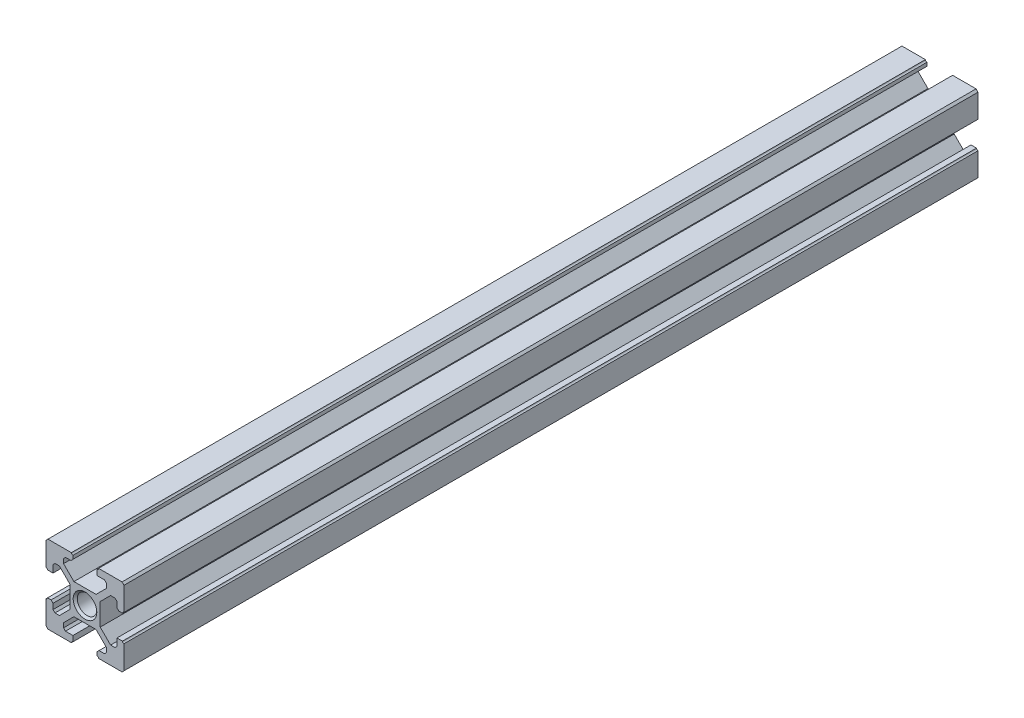
from build123d import *

# Parameters (mm, degrees)
BOSS_EXTRUDE1_DEPTH             = 219
M6X1_0_TAPPED_HOLE2_D           = 5
M6X1_0_TAPPED_HOLE2_DEPTH       = 28.497848452
M6X1_0_TAPPED_HOLE2_CSINK_D     = 6.05
M6X1_0_TAPPED_HOLE2_CSINK_ANGLE = 90
M6X1_0_TAPPED_HOLE2_TIP         = 1.502151548


with BuildPart() as part:
    # Sketch1 → Boss-Extrude1 (new body)
    with BuildSketch(Plane.XY):
        with BuildLine():
            Line((-9.5, 10), (-3.486470896, 10))
            ThreePointArc((-3.486470896, 10), (-3.373276191, 9.726723809), (-3.1, 9.613529104))
            Line((-3.1, 9.613529104), (-3.1, 8.7))
            Line((-3.1, 8.7), (-3.6, 8.2))
            Line((-3.6, 8.2), (-5, 8.2))
            Line((-5, 8.2), (-5.5, 7.7))
            Line((-5.5, 7.7), (-5.5, 6.560660172))
            Line((-5.5, 6.560660172), (-2.839339828, 3.9))
            Line((-2.839339828, 3.9), (0, 3.9))
            Line((0, 3.9), (2.839339828, 3.9))
            Line((2.839339828, 3.9), (5.5, 6.560660172))
            Line((5.5, 6.560660172), (5.5, 7.7))
            Line((5.5, 7.7), (5, 8.2))
            Line((5, 8.2), (3.1, 8.2))
            Line((3.1, 8.2), (3.1, 9.613529104))
            ThreePointArc((3.1, 9.613529104), (3.373276191, 9.726723809), (3.486470896, 10))
            Line((3.486470896, 10), (9.5, 10))
            Line((9.5, 10), (10, 9.5))
            Line((10, 9.5), (10, 3.486470896))
            ThreePointArc((10, 3.486470896), (9.726723809, 3.373276191), (9.613529104, 3.1))
            Line((9.613529104, 3.1), (8.7, 3.1))
            Line((8.7, 3.1), (8.2, 3.6))
            Line((8.2, 3.6), (8.2, 5))
            Line((8.2, 5), (7.7, 5.5))
            Line((7.7, 5.5), (6.560660172, 5.5))
            Line((6.560660172, 5.5), (3.9, 2.839339828))
            Line((3.9, 2.839339828), (3.9, 0))
            Line((3.9, 0), (3.9, -2.839339828))
            Line((3.9, -2.839339828), (6.560660172, -5.5))
            Line((6.560660172, -5.5), (7.7, -5.5))
            Line((7.7, -5.5), (8.2, -5))
            Line((8.2, -5), (8.2, -3.1))
            Line((8.2, -3.1), (9.613529104, -3.1))
            ThreePointArc((9.613529104, -3.1), (9.726723809, -3.373276191), (10, -3.486470896))
            Line((10, -3.486470896), (10, -9.5))
            Line((10, -9.5), (9.5, -10))
            Line((9.5, -10), (3.486470896, -10))
            ThreePointArc((3.486470896, -10), (3.373276191, -9.726723809), (3.1, -9.613529104))
            Line((3.1, -9.613529104), (3.1, -8.7))
            Line((3.1, -8.7), (3.6, -8.2))
            Line((3.6, -8.2), (5, -8.2))
            Line((5, -8.2), (5.5, -7.7))
            Line((5.5, -7.7), (5.5, -6.560660172))
            Line((5.5, -6.560660172), (2.839339828, -3.9))
            Line((2.839339828, -3.9), (0, -3.9))
            Line((0, -3.9), (-2.839339828, -3.9))
            Line((-2.839339828, -3.9), (-5.5, -6.560660172))
            Line((-5.5, -6.560660172), (-5.5, -7.7))
            Line((-5.5, -7.7), (-5, -8.2))
            Line((-5, -8.2), (-3.1, -8.2))
            Line((-3.1, -8.2), (-3.1, -9.613529104))
            ThreePointArc((-3.1, -9.613529104), (-3.373276191, -9.726723809), (-3.486470896, -10))
            Line((-3.486470896, -10), (-9.5, -10))
            Line((-9.5, -10), (-10, -9.5))
            Line((-10, -9.5), (-10, -3.486470896))
            ThreePointArc((-10, -3.486470896), (-9.726723809, -3.373276191), (-9.613529104, -3.1))
            Line((-9.613529104, -3.1), (-8.7, -3.1))
            Line((-8.7, -3.1), (-8.2, -3.6))
            Line((-8.2, -3.6), (-8.2, -5))
            Line((-8.2, -5), (-7.7, -5.5))
            Line((-7.7, -5.5), (-6.560660172, -5.5))
            Line((-6.560660172, -5.5), (-3.9, -2.839339828))
            Line((-3.9, -2.839339828), (-3.9, 0))
            Line((-3.9, 0), (-3.9, 2.839339828))
            Line((-3.9, 2.839339828), (-6.560660172, 5.5))
            Line((-6.560660172, 5.5), (-7.7, 5.5))
            Line((-7.7, 5.5), (-8.2, 5))
            Line((-8.2, 5), (-8.2, 3.1))
            Line((-8.2, 3.1), (-9.613529104, 3.1))
            ThreePointArc((-9.613529104, 3.1), (-9.726723809, 3.373276191), (-10, 3.486470896))
            Line((-10, 3.486470896), (-10, 9.5))
            Line((-10, 9.5), (-9.5, 10))
        make_face()
    extrude(amount=BOSS_EXTRUDE1_DEPTH)

    # Sketch2 → M6x1.0 Tapped Hole1 (revolve, cut)
    with BuildSketch(Plane(origin=(0, 0, 219), x_dir=(0, -1, 0), z_dir=(1, 0, 0))):
        Polygon((0, 0), (0, 30), (2.5, 28.497848452), (2.5, 0.525), (3.025, 0), align=None)
    revolve(axis=Axis((0, 0, 225.35), (0, 0, -1)), mode=Mode.SUBTRACT)

    # M6x1.0 Tapped Hole2
    with Locations(Plane(origin=(0, 0, 0), x_dir=(-1, 0, 0), z_dir=(0, 0, -1))):
        with Locations((0, 0)):
            CounterSinkHole(M6X1_0_TAPPED_HOLE2_D / 2, M6X1_0_TAPPED_HOLE2_CSINK_D / 2, depth=M6X1_0_TAPPED_HOLE2_DEPTH, counter_sink_angle=M6X1_0_TAPPED_HOLE2_CSINK_ANGLE)
            with Locations((0, 0, -(M6X1_0_TAPPED_HOLE2_DEPTH + M6X1_0_TAPPED_HOLE2_TIP / 2))):  # 118° drill point
                Cone(0, M6X1_0_TAPPED_HOLE2_D / 2, M6X1_0_TAPPED_HOLE2_TIP, mode=Mode.SUBTRACT)


solid = part.part
